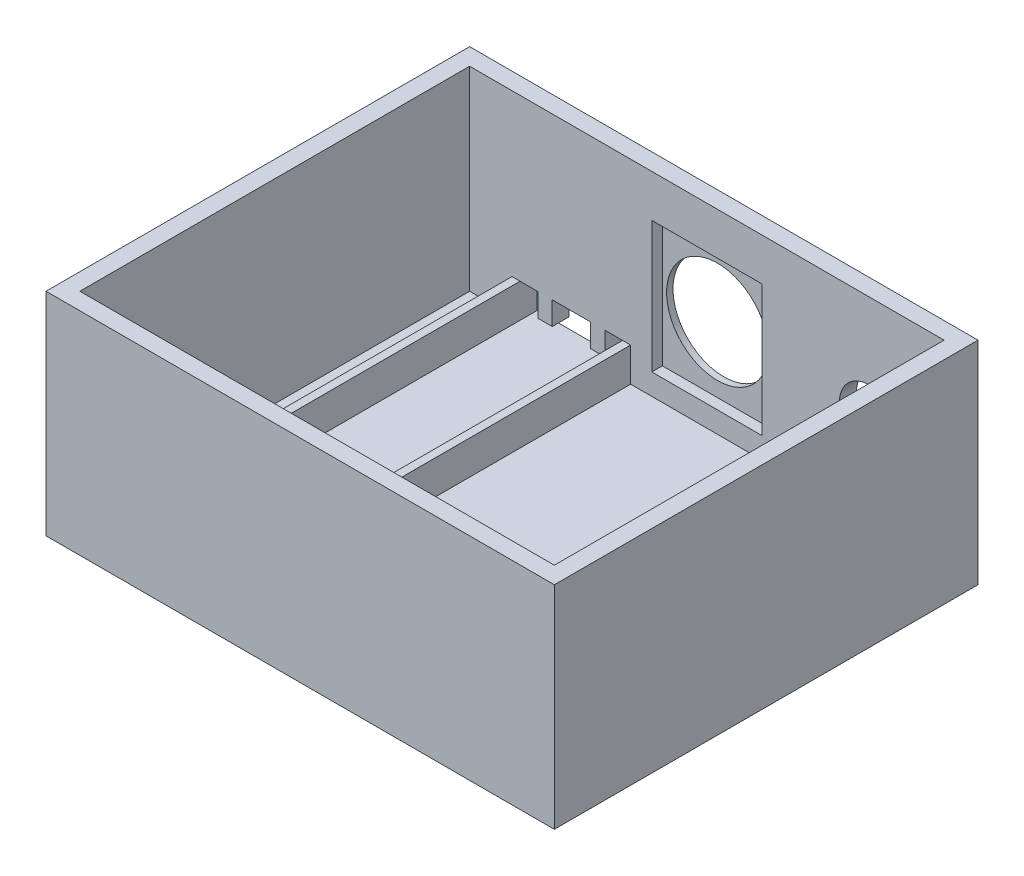
from build123d import *

# Parameters (mm, degrees)
SKETCH1_W           = 120
SKETCH1_H           = 100
BOSS_EXTRUDE1_DEPTH = 50
SKETCH2_W           = 112
SKETCH2_H           = 92
CUT_EXTRUDE1_DEPTH  = 46
SKETCH3_W           = 28
SKETCH3_H           = 70
BOSS_EXTRUDE3_DEPTH = 8
SKETCH6_W           = 24.21
SKETCH6_H           = 8
CUT_EXTRUDE4_DEPTH  = 66
CUT_EXTRUDE6_DEPTH  = 66
SKETCH8_W           = 26
SKETCH8_H           = 31
CUT_EXTRUDE7_DEPTH  = 2.5
SKETCH9_R           = 12
CUT_EXTRUDE8_DEPTH  = 2.5
SKETCH10_R          = 7
CUT_EXTRUDE9_DEPTH  = 12.5


with BuildPart() as part:
    # Sketch1 → Boss-Extrude1 (new body)
    with BuildSketch(Plane(origin=(0, 0, 0), x_dir=(1, 0, 0), z_dir=(0, 1, 0))):
        with Locations((-10.571222942, 10.082692781)):
            Rectangle(SKETCH1_W, SKETCH1_H)
    extrude(amount=BOSS_EXTRUDE1_DEPTH)

    # Sketch2 → Cut-Extrude1 (cut)
    with BuildSketch(Plane(origin=(0, 50, 0), x_dir=(1, 0, 0), z_dir=(0, 1, 0))):
        with Locations((-10.571222942, 10.082692781)):
            Rectangle(SKETCH2_W, SKETCH2_H)
    extrude(amount=-CUT_EXTRUDE1_DEPTH, mode=Mode.SUBTRACT)

    # Sketch3 → Boss-Extrude3 (add)
    with BuildSketch(Plane(origin=(0, 4, 0), x_dir=(1, 0, 0), z_dir=(0, 1, 0))):
        with Locations((-42.571222942, 25.082692781)):
            Rectangle(SKETCH3_W, SKETCH3_H)
    extrude(amount=BOSS_EXTRUDE3_DEPTH)

    # Sketch6 → Cut-Extrude4 (cut)
    with BuildSketch(Plane.XY.offset(9.917307219)):
        with Locations((-42.569304131, 8)):
            Rectangle(SKETCH6_W, SKETCH6_H)
    extrude(amount=-CUT_EXTRUDE4_DEPTH, mode=Mode.SUBTRACT)

    # Sketch7 → Cut-Extrude6 (cut)
    with BuildSketch(Plane.XY.offset(-56.082692781)):
        Polygon((-54.674304131, 12), (-50.474304131, 12), (-50.474304131, 6.53), (-47.074304131, 6.53), (-47.074304131, 12), (-38.074304131, 12), (-38.074304131, 6.53), (-34.664304131, 6.53), (-34.664304131, 12), (-30.464304131, 12), (-30.464304131, 6.53), (-30.464304131, 4), (-54.674304131, 4), (-54.674304131, 6.53), align=None)
    extrude(amount=-CUT_EXTRUDE6_DEPTH, mode=Mode.SUBTRACT)

    # Sketch8 → Cut-Extrude7 (cut)
    with BuildSketch(Plane.XY.offset(-56.082692781)):
        with Locations((-10.571222942, 24.5)):
            Rectangle(SKETCH8_W, SKETCH8_H)
    extrude(amount=-CUT_EXTRUDE7_DEPTH, mode=Mode.SUBTRACT)

    # Sketch9 → Cut-Extrude8 (cut)
    with BuildSketch(Plane.XY.offset(-58.582692781)):
        with Locations((-10.571222942, 24.5)):
            Circle(SKETCH9_R)
    extrude(amount=-CUT_EXTRUDE8_DEPTH, mode=Mode.SUBTRACT)

    # Sketch10 → Cut-Extrude9 (cut)
    with BuildSketch(Plane(origin=(0, 0, -60.082692781), x_dir=(-1, 0, 0), z_dir=(0, 0, -1))):
        with Locations((-27.728777058, 25)):
            Circle(SKETCH10_R)
    extrude(amount=-CUT_EXTRUDE9_DEPTH, mode=Mode.SUBTRACT)


solid = part.part
